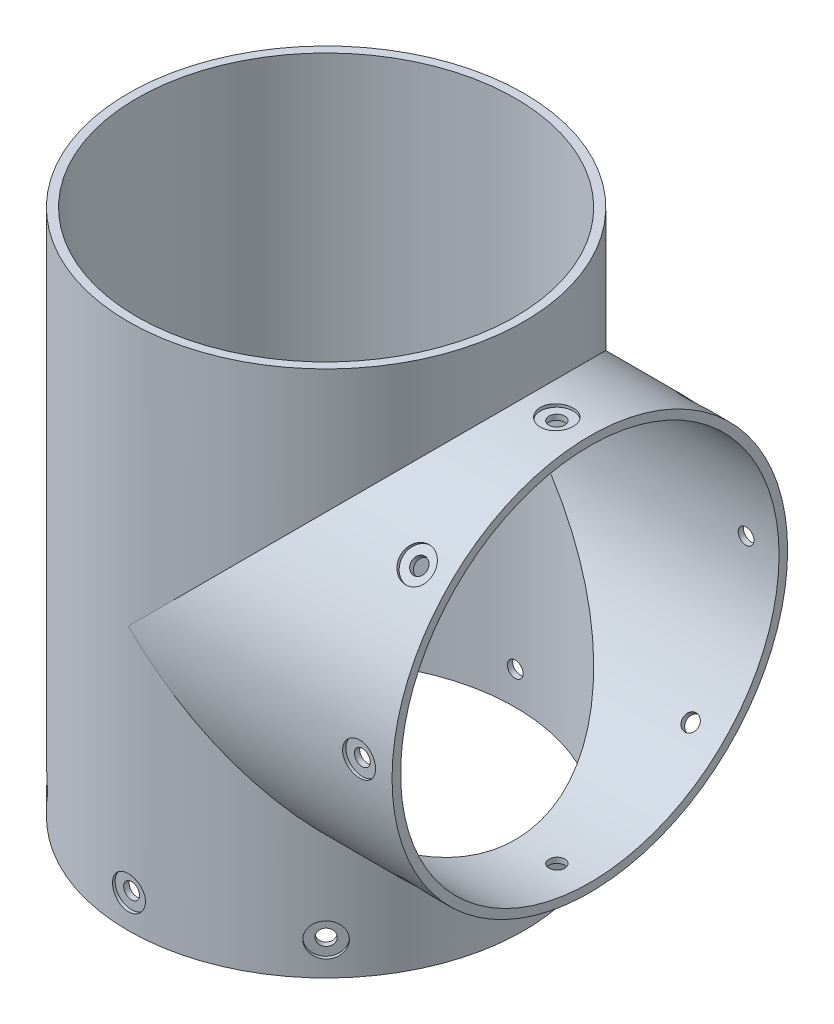
from build123d import *

# Parameters (mm, degrees)
SKETCH_1_R               = 30
EXTRUDE_1_DEPTH          = 80
PATTERN_CIRCULAR_1_COUNT = 8
SKETCH_10_R              = 30
EXTRUDE_2_DEPTH          = 40
SKETCH_11_R              = 28.7
CUT_EXTRUDE_2_DEPTH      = 40
SKETCH_12_R              = 28.7
CUT_EXTRUDE_3_DEPTH      = 95.339811437
PATTERN_CIRCULAR_2_COUNT = 8


with BuildPart() as part:
    # 스케치1 → 보스-돌출1 (new body)
    with BuildSketch(Plane(origin=(0, 0, 0), x_dir=(1, 0, 0), z_dir=(0, 1, 0))):
        with Locations(Location((0, 0, 0), (0, 0, 270))):
            Circle(SKETCH_1_R)
    extrude(amount=EXTRUDE_1_DEPTH)

    # 스케치9 → M2 남비 머리 나사용 카운터보어1 (revolve, cut)
    with BuildSketch(Plane(origin=(-30, 5, 0), x_dir=(0, 0, 1), z_dir=(0, 1, 0))):
        Polygon((0, 0), (0, 10.721032743), (1.2, 10), (1.2, 0.5), (2.5, 0.5), (2.5, 0), align=None)
    hole_wizard_m2_1 = revolve(axis=Axis((-36.35, 5, 0), (1, 0, 0)), mode=Mode.SUBTRACT)

    # 원형 패턴1: M2 남비 머리 나사용 카운터보어1 ×8 about axis
    pattern_circular_1_axis = Axis((0, 0, 0), (0, 1, 0))
    for i in range(1, PATTERN_CIRCULAR_1_COUNT):
        add(hole_wizard_m2_1.rotate(pattern_circular_1_axis, i * 360 / PATTERN_CIRCULAR_1_COUNT), mode=Mode.SUBTRACT)

    # 스케치10 → 보스-돌출2 (add)
    with BuildSketch(Plane(origin=(0, 0, 0), x_dir=(0, 0, -1), z_dir=(1, 0, 0))):
        with Locations((0, 40)):
            Circle(SKETCH_10_R)
    extrude(amount=EXTRUDE_2_DEPTH)

    # 스케치11 → 컷-돌출2 (cut)
    with BuildSketch(Plane(origin=(40, 0, 0), x_dir=(0, 0, -1), z_dir=(1, 0, 0))):
        with Locations((0, 40)):
            Circle(SKETCH_11_R)
    extrude(amount=-CUT_EXTRUDE_2_DEPTH, mode=Mode.SUBTRACT)

    # 스케치12 → 컷-돌출3 (cut, through all)
    with BuildSketch(Plane(origin=(0, 80, 0), x_dir=(1, 0, 0), z_dir=(0, 1, 0))):
        with Locations(Location((0, 0, 0), (0, 0, 270))):
            Circle(SKETCH_12_R)
    extrude(amount=-CUT_EXTRUDE_3_DEPTH, mode=Mode.SUBTRACT)

    # 스케치15 → M2 남비 머리 나사용 카운터보어2 (revolve, cut)
    with BuildSketch(Plane(origin=(35, 70, 0), x_dir=(0, 0, 1), z_dir=(1, 0, 0))):
        Polygon((0, 0), (0, 10.721032743), (1.2, 10), (1.2, 0.5), (2.5, 0.5), (2.5, 0), align=None)
    hole_wizard_m2_2 = revolve(axis=Axis((35, 76.35, 0), (0, -1, 0)), mode=Mode.SUBTRACT)

    # 원형 패턴2: M2 남비 머리 나사용 카운터보어2 ×8 about axis
    pattern_circular_2_axis = Axis((0, 40, 0), (1, 0, 0))
    for i in range(1, PATTERN_CIRCULAR_2_COUNT):
        add(hole_wizard_m2_2.rotate(pattern_circular_2_axis, i * 360 / PATTERN_CIRCULAR_2_COUNT), mode=Mode.SUBTRACT)


solid = part.part
